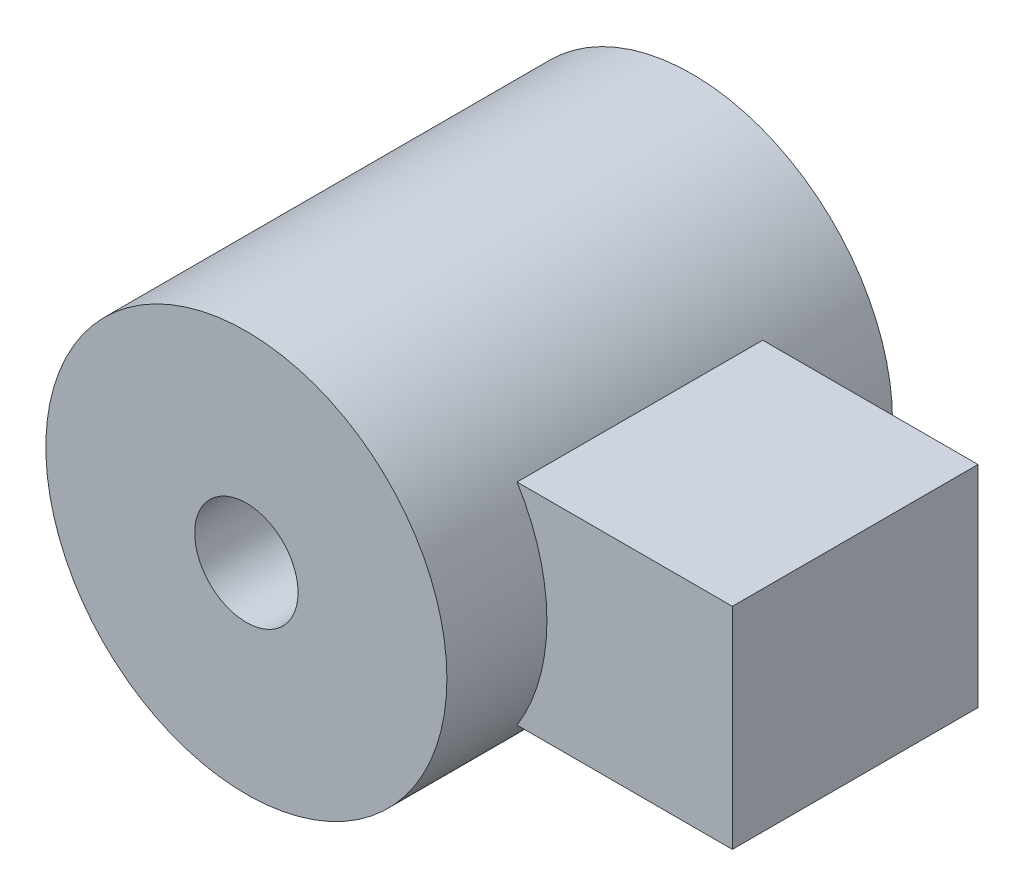
from build123d import *

# Parameters (mm, degrees)
SKETCH1_R           = 5.715
BOSS_EXTRUDE1_DEPTH = 12.7
SKETCH2_R           = 1.4732
CUT_EXTRUDE1_DEPTH  = 16.053652381
SKETCH3_W           = 7
SKETCH3_H           = 6
BOSS_EXTRUDE2_DEPTH = 7


with BuildPart() as part:
    # Sketch1 → Boss-Extrude1 (new body)
    with BuildSketch(Plane.XY):
        with Locations(Location((0, 0, 0), (0, 0, 180))):
            Circle(SKETCH1_R)
    extrude(amount=BOSS_EXTRUDE1_DEPTH)

    # Sketch2 → Cut-Extrude1 (cut, through all)
    with BuildSketch(Plane.XY.offset(12.7)):
        Circle(SKETCH2_R)
    extrude(amount=-CUT_EXTRUDE1_DEPTH, mode=Mode.SUBTRACT)

    # Sketch3 → Boss-Extrude2 (add)
    with BuildSketch(Plane(origin=(4, 0, 0), x_dir=(0, 0, -1), z_dir=(1, 0, 0))):
        with Locations((-6.35, 0)):
            Rectangle(SKETCH3_W, SKETCH3_H)
    extrude(amount=BOSS_EXTRUDE2_DEPTH)


solid = part.part
